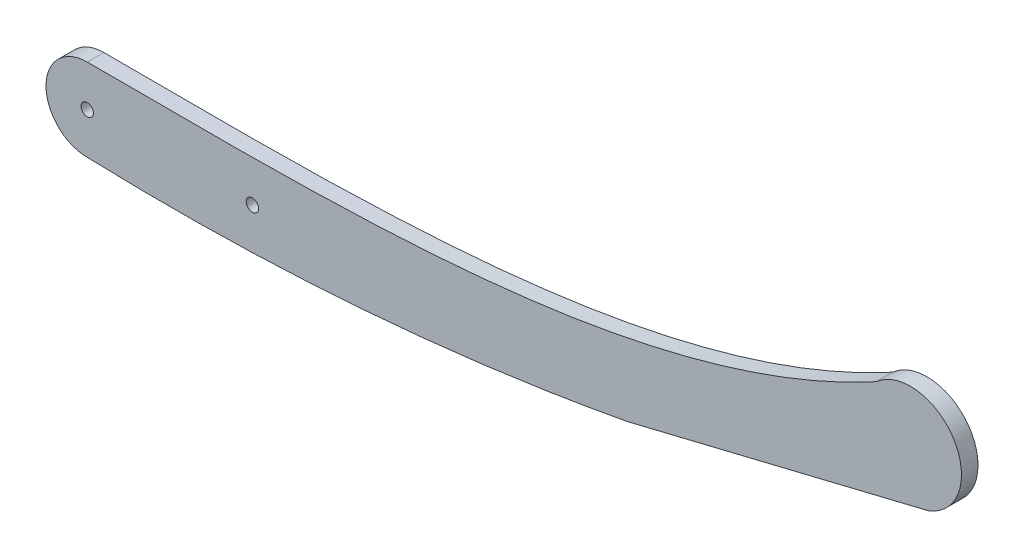
from build123d import *

# Parameters (mm, degrees)
SKETCH_1_R      = 1.5
EXTRUDE_1_DEPTH = 4


with BuildPart() as part:
    # 草图1 → 凸台-拉伸1 (new body)
    with BuildSketch(Plane.XY):
        with BuildLine():
            add(Edge.make_bspline(
                [(0, 10), (52.11400991, 10.48088872), (106.792215868, 14.291406746), (151.130268959, 38.519700222)],
                knots=[0.172138622, 0.172138622, 0.172138622, 0.172138622, 0.832549304, 0.832549304, 0.832549304, 0.832549304], degree=3))
            add(Edge.make_bspline(
                [(-0.183054557, 9.998324411), (-0.122039901, 9.998878394), (-0.061021708, 9.999436914), (0, 10)],
                knots=[0.17136533, 0.17136533, 0.17136533, 0.17136533, 0.172138622, 0.172138622, 0.172138622, 0.172138622], degree=3))
            add(Edge.make_bspline(
                [(-39.962254298, 9.999928763), (-27.025718651, 9.975441168), (-13.691052102, 9.875678503), (-0.183054557, 9.998324411)],
                knots=[0.000166511, 0.000166511, 0.000166511, 0.000166511, 0.17136533, 0.17136533, 0.17136533, 0.17136533], degree=3))
            ThreePointArc((-39.962254298, 9.999928763), (-39.981127115, 9.999982191), (-40, 10))
            ThreePointArc((-40, 10), (-50, 0), (-40, -10))
            add(Edge.make_bspline(
                [(-40, -10), (-26.629572895, -10.441521612), (-13.296239562, -10.441521612), (0, -10)],
                knots=[0, 0, 0, 0, 0.198467229, 0.198467229, 0.198467229, 0.198467229], degree=3))
            add(Edge.make_bspline(
                [(0, -10), (0.224885721, -9.992532332), (0.449760832, -9.984938359), (0.674625331, -9.977218082)],
                knots=[0.198467229, 0.198467229, 0.198467229, 0.198467229, 0.201824001, 0.201824001, 0.201824001, 0.201824001], degree=3))
            add(Edge.make_bspline(
                [(0.674625331, -9.977218082), (30.932305536, -8.938380612), (60.997855132, -5.612641251), (90.871274119, 0)],
                knots=[0.201824001, 0.201824001, 0.201824001, 0.201824001, 0.653509958, 0.653509958, 0.653509958, 0.653509958], degree=3))
            Line((90.871274119, 0), (163.684000861, 17.723388911))
            ThreePointArc((163.684000861, 17.723388911), (171.094194245, 33.297976406), (155.725788693, 41.126823857))
            ThreePointArc((155.725788693, 41.126823857), (153.287141392, 40.071601234), (151.130268959, 38.519700222))
        make_face()
        with Locations((-40, 0)):
            Circle(SKETCH_1_R, mode=Mode.SUBTRACT)
        Circle(SKETCH_1_R, mode=Mode.SUBTRACT)
    extrude(amount=EXTRUDE_1_DEPTH)


solid = part.part
